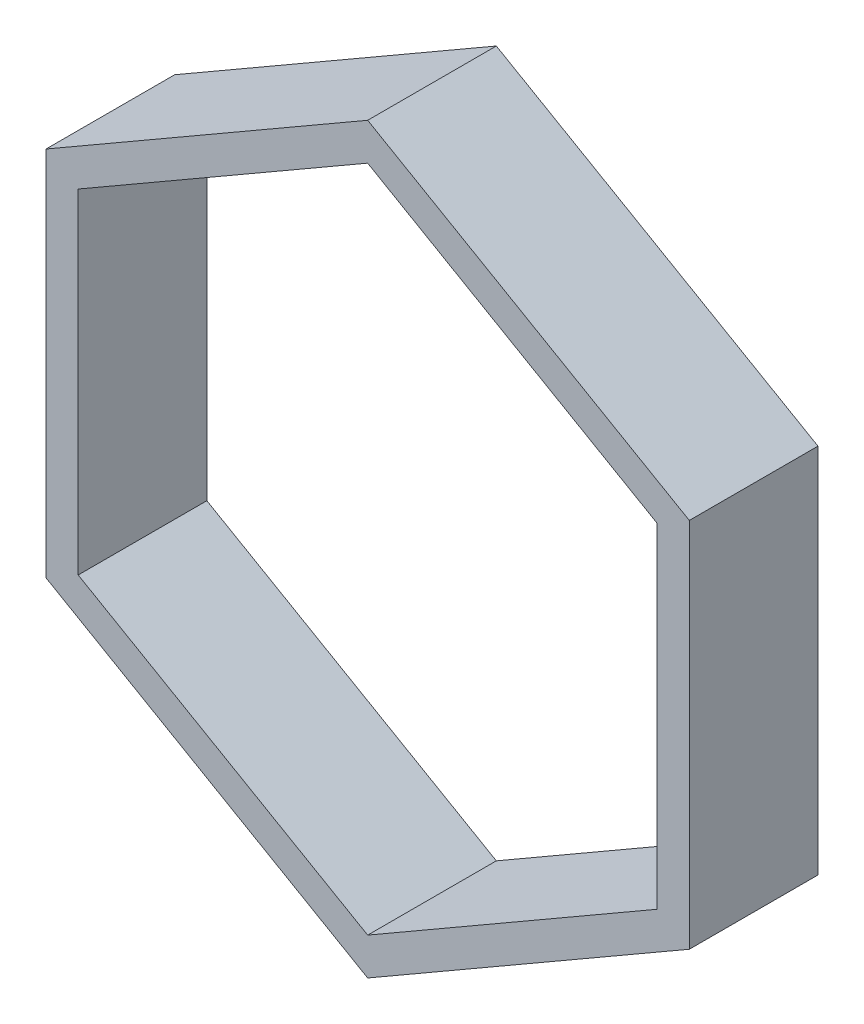
from build123d import *

# Parameters (mm, degrees)
BOSS_EXTRUDE1_DEPTH = 4


with BuildPart() as part:
    # Sketch1 → Boss-Extrude1 (new body)
    with BuildSketch(Plane.XY):
        Polygon((0, 11.547005384), (-10, 5.773502692), (-10, -5.773502692), (0, -11.547005384), (10, -5.773502692), (10, 5.773502692), align=None)
        Polygon((0, 10.392304845), (-9, 5.196152423), (-9, -5.196152423), (0, -10.392304845), (9, -5.196152423), (9, 5.196152423), align=None, mode=Mode.SUBTRACT)
    extrude(amount=BOSS_EXTRUDE1_DEPTH)


solid = part.part
